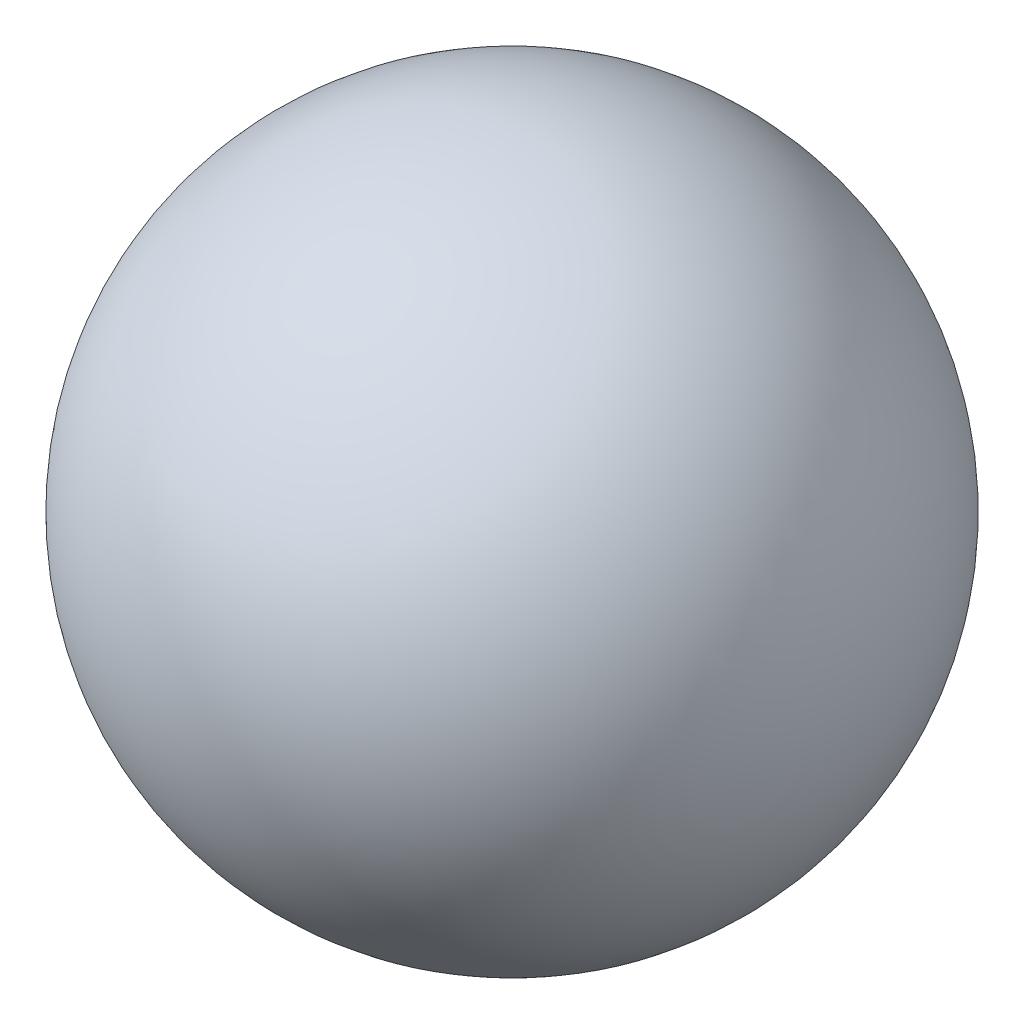
from build123d import *


with BuildPart() as part:
    # Sketch1 → Revolve1 (revolve)
    with BuildSketch(Plane.XY):
        with BuildLine():
            Line((0, 95), (0, -95))
            ThreePointArc((0, -95), (-95, 0), (0, 95))
        make_face()
    revolve(axis=Axis((0, 95, 0), (0, -1, 0)))


solid = part.part
